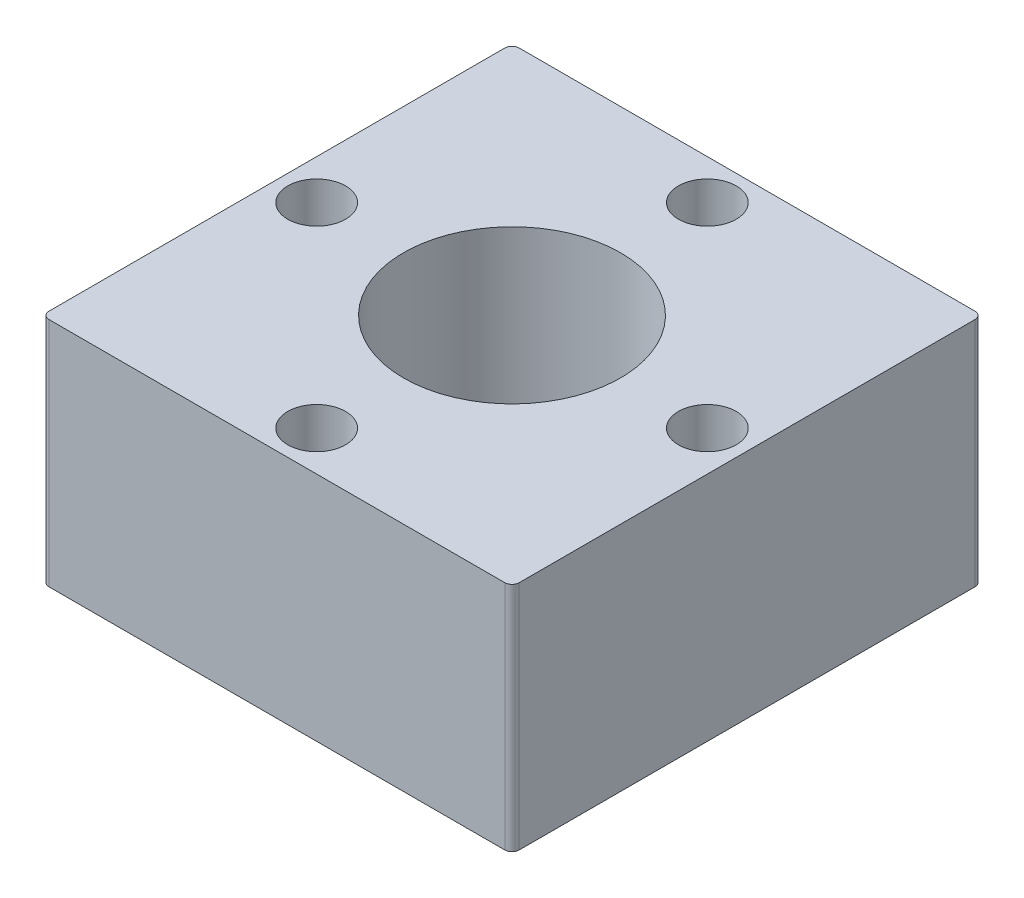
from build123d import *

# Parameters (mm, degrees)
CROQUIS2_W              = 65
CROQUIS2_H              = 65
CROQUIS2_R              = 15
CROQUIS2_R_2            = 4
SALIENTE_EXTRUIR1_DEPTH = 32
CROQUIS3_R              = 15
CROQUIS3_R_2            = 13.5
SALIENTE_EXTRUIR2_DEPTH = 7
REDONDEO1_R             = 1


with BuildPart() as part:
    # Croquis2 → Saliente-Extruir1 (new body)
    with BuildSketch(Plane(origin=(0, 0, 0), x_dir=(1, 0, 0), z_dir=(0, 1, 0))):
        Rectangle(CROQUIS2_W, CROQUIS2_H)
        with Locations(Location((0, 0, 0), (0, 0, 270))):
            Circle(CROQUIS2_R, mode=Mode.SUBTRACT)
        with Locations(Location((-27, 0, 0), (0, 0, 270))):
            Circle(CROQUIS2_R_2, mode=Mode.SUBTRACT)
        with Locations(Location((27, 0, 0), (0, 0, 270))):
            Circle(CROQUIS2_R_2, mode=Mode.SUBTRACT)
        with Locations(Location((0, 27, 0), (0, 0, 270))):
            Circle(CROQUIS2_R_2, mode=Mode.SUBTRACT)
        with Locations(Location((0, -27, 0), (0, 0, 270))):
            Circle(CROQUIS2_R_2, mode=Mode.SUBTRACT)
    extrude(amount=SALIENTE_EXTRUIR1_DEPTH)

    # Croquis3 → Saliente-Extruir2 (add)
    with BuildSketch(Plane(origin=(0, 0, 0), x_dir=(1, 0, 0), z_dir=(0, 1, 0))):
        with Locations(Location((0, 0, 0), (0, 0, 270))):
            Circle(CROQUIS3_R)
        with Locations(Location((0, 0, 0), (0, 0, 270))):
            Circle(CROQUIS3_R_2, mode=Mode.SUBTRACT)
    extrude(amount=SALIENTE_EXTRUIR2_DEPTH)

    # Redondeo1
    redondeo1_edges = [part.edges().sort_by_distance(p)[0] for p in [
        (-32.5, 16, -32.5),
        (32.5, 16, -32.5),
        (32.5, 16, 32.5),
        (-32.5, 16, 32.5),
    ]]
    fillet(redondeo1_edges, radius=REDONDEO1_R)


solid = part.part
